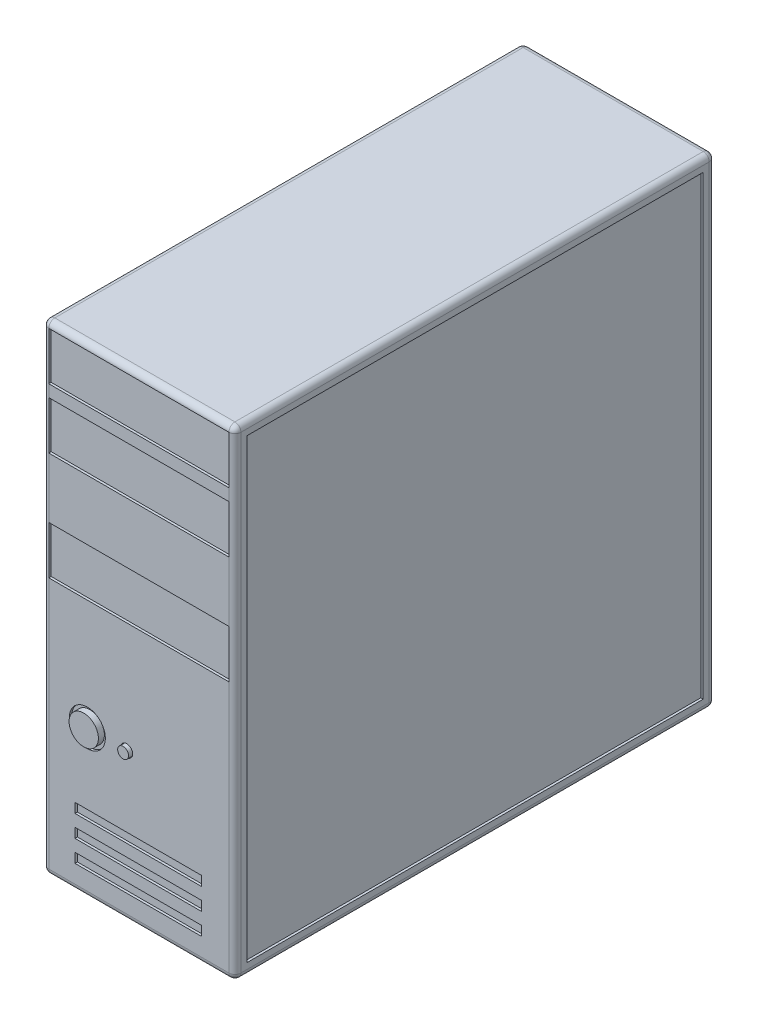
from build123d import *

# Parameters (mm, degrees)
CROQUIS1_W              = 160
CROQUIS1_H              = 400
SALIENTE_EXTRUIR1_DEPTH = 400
REDONDEO1_R             = 5
CROQUIS2_R              = 15
CROQUIS2_R_2            = 5
CROQUIS2_W              = 150
CROQUIS2_H              = 40
CROQUIS2_W_2            = 105.514825976
CROQUIS2_H_2            = 8
CORTAR_EXTRUIR1_DEPTH   = 2
CROQUIS3_R              = 12.203694642
CROQUIS3_R_2            = 4.521298069
SALIENTE_EXTRUIR2_DEPTH = 5
CROQUIS4_W              = 380
CROQUIS4_H              = 380
CORTAR_EXTRUIR2_DEPTH   = 2
CROQUIS5_W              = 380
CROQUIS5_H              = 380
CORTAR_EXTRUIR3_DEPTH   = 2


with BuildPart() as part:
    # Croquis1 → Saliente-Extruir1 (new body)
    with BuildSketch(Plane.XY):
        Rectangle(CROQUIS1_W, CROQUIS1_H)
    extrude(amount=-SALIENTE_EXTRUIR1_DEPTH)

    # Redondeo1
    redondeo1_edges = [part.edges().sort_by_distance(p)[0] for p in [
        (80, 0, -400),
        (0, 200, -400),
        (-80, 0, -400),
        (0, 200, 0),
        (80, 0, 0),
        (0, -200, 0),
        (-80, 0, 0),
        (0, -200, -400),
        (-80, 200, -200),
        (80, 200, -200),
        (80, -200, -200),
        (-80, -200, -200),
    ]]
    fillet(redondeo1_edges, radius=REDONDEO1_R)

    # Croquis2 → Cortar-Extruir1 (cut)
    with BuildSketch(Plane.XY):
        with Locations((-42.906419047, -77.137880051)):
            Circle(CROQUIS2_R)
        with Locations((-10.118013228, -77.137880051)):
            Circle(CROQUIS2_R_2)
        with Locations((0, 175)):
            Rectangle(CROQUIS2_W, CROQUIS2_H)
        with Locations((0, 125)):
            Rectangle(CROQUIS2_W, CROQUIS2_H)
        with Locations((0, 35)):
            Rectangle(CROQUIS2_W, CROQUIS2_H)
        with Locations((-0.46526055, -176)):
            Rectangle(CROQUIS2_W_2, CROQUIS2_H_2)
        with Locations((-0.46526055, -158)):
            Rectangle(CROQUIS2_W_2, CROQUIS2_H_2)
        with Locations((-0.46526055, -140)):
            Rectangle(CROQUIS2_W_2, CROQUIS2_H_2)
    extrude(amount=-CORTAR_EXTRUIR1_DEPTH, mode=Mode.SUBTRACT)

    # Croquis3 → Saliente-Extruir2 (add)
    with BuildSketch(Plane.XY.offset(-2)):
        with Locations((-42.906419047, -77.137880051)):
            Circle(CROQUIS3_R)
        with Locations((-10.118013228, -77.137880051)):
            Circle(CROQUIS3_R_2)
    extrude(amount=SALIENTE_EXTRUIR2_DEPTH)

    # Croquis4 → Cortar-Extruir2 (cut)
    with BuildSketch(Plane.ZY.offset(80)):
        with Locations((-200, 0)):
            Rectangle(CROQUIS4_W, CROQUIS4_H)
    extrude(amount=-CORTAR_EXTRUIR2_DEPTH, mode=Mode.SUBTRACT)

    # Croquis5 → Cortar-Extruir3 (cut)
    with BuildSketch(Plane(origin=(80, 0, 0), x_dir=(0, 0, -1), z_dir=(1, 0, 0))):
        with Locations((200, 0)):
            Rectangle(CROQUIS5_W, CROQUIS5_H)
    extrude(amount=-CORTAR_EXTRUIR3_DEPTH, mode=Mode.SUBTRACT)


solid = part.part
